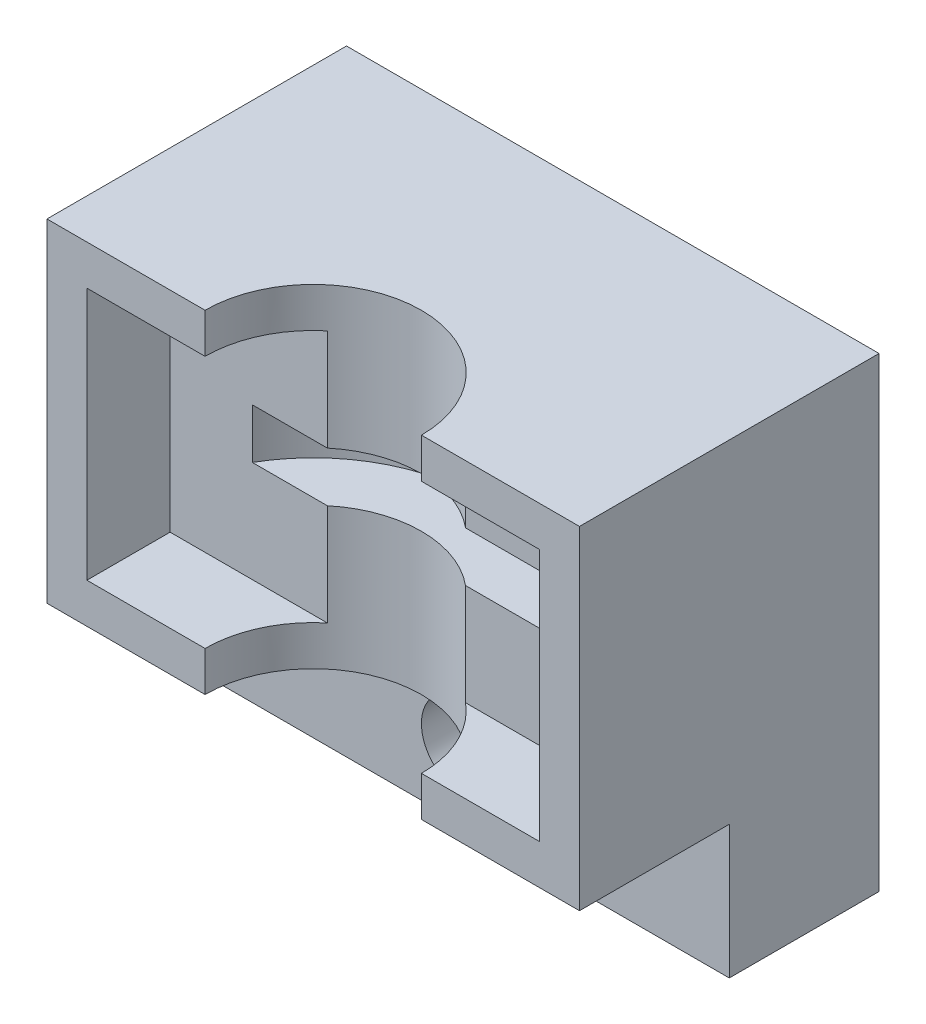
from build123d import *

# Parameters (mm, degrees)
SKETCH_1_W          = 160
SKETCH_1_H          = 140
EXTRUDE_1_DEPTH     = 45
SKETCH_2_W          = 160
SKETCH_2_H          = 100
EXTRUDE_2_DEPTH     = 45
SKETCH_3_R          = 12.5
CUT_EXTRUDE_1_DEPTH = 116.433963806
SKETCH_4_R          = 32.5
CUT_EXTRUDE_2_DEPTH = 157.524758425
SKETCH_5_R          = 50
CUT_EXTRUDE_3_DEPTH = 7.5
SKETCH_7_W          = 136
SKETCH_7_H          = 76
CUT_EXTRUDE_4_DEPTH = 25


with BuildPart() as part:
    # Эскиз1 → Бобышка-Вытянуть1 (new body)
    with BuildSketch(Plane.XY):
        Rectangle(SKETCH_1_W, SKETCH_1_H)
    extrude(amount=EXTRUDE_1_DEPTH)

    # Эскиз2 → Бобышка-Вытянуть2 (add)
    with BuildSketch(Plane.XY.offset(45)):
        with Locations((0, 20)):
            Rectangle(SKETCH_2_W, SKETCH_2_H)
    extrude(amount=EXTRUDE_2_DEPTH)

    # Эскиз3 → Вырез-Вытянуть1 (cut, through all)
    with BuildSketch(Plane.XY.offset(45)):
        with Locations((0, -50)):
            Circle(SKETCH_3_R)
    extrude(amount=-CUT_EXTRUDE_1_DEPTH, mode=Mode.SUBTRACT)

    # Эскиз4 → Вырез-Вытянуть2 (cut, through all)
    with BuildSketch(Plane.XZ.offset(30)):
        with Locations((0, 90)):
            Circle(SKETCH_4_R)
    extrude(amount=-CUT_EXTRUDE_2_DEPTH, mode=Mode.SUBTRACT)

    # Эскиз5 → Вырез-Вытянуть3 (cut, symmetric)
    with BuildSketch(Plane(origin=(0, 20, 0), x_dir=(-1, 0, 0), z_dir=(0, -1, 0))):
        with Locations((0, -90)):
            Circle(SKETCH_5_R)
    extrude(amount=CUT_EXTRUDE_3_DEPTH, both=True, mode=Mode.SUBTRACT)

    # Эскиз7 → Вырез-Вытянуть4 (cut)
    with BuildSketch(Plane.XY.offset(90)):
        with Locations((0, 20)):
            Rectangle(SKETCH_7_W, SKETCH_7_H)
    extrude(amount=-CUT_EXTRUDE_4_DEPTH, mode=Mode.SUBTRACT)


solid = part.part
